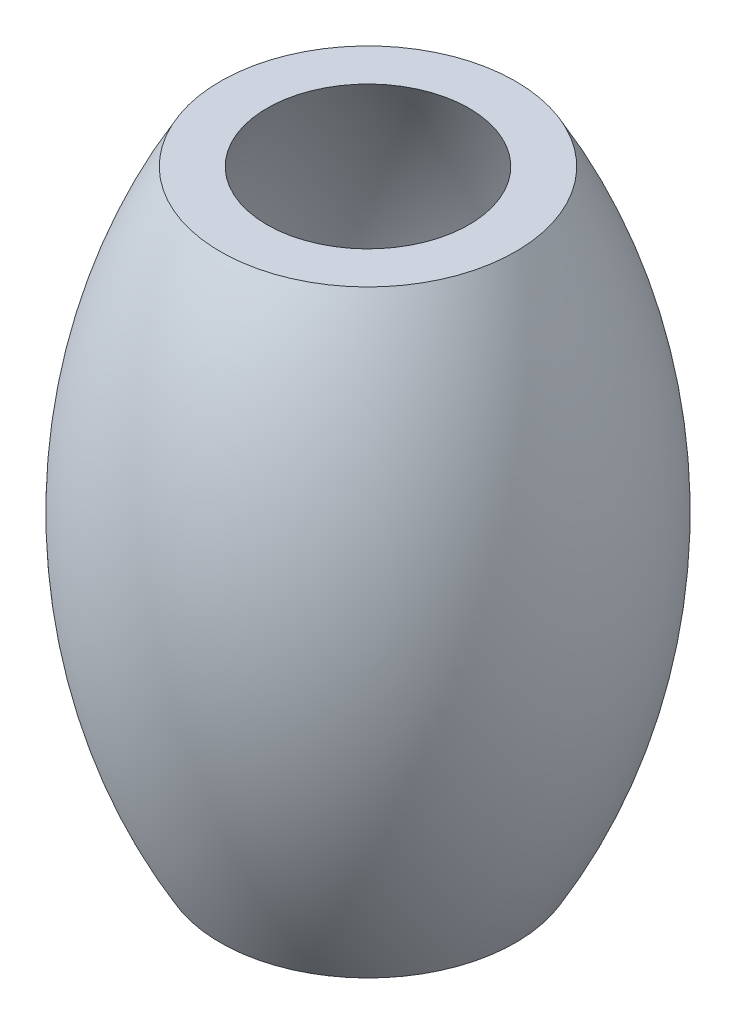
from build123d import *


with BuildPart() as part:
    # Sketch1 → Revolve1 (revolve)
    with BuildSketch(Plane.XY, mode=Mode.PRIVATE) as revolve1_sk:
        with BuildLine():
            Line((-2.531209361, 7.5), (-3.7, 7.5))
            ThreePointArc((-3.7, 7.5), (-5.709618943, 0), (-3.7, -7.5))
            Line((-3.7, -7.5), (-2.531209361, -7.5))
            ThreePointArc((-2.531209361, -7.5), (-4.709618943, 0), (-2.531209361, 7.5))
        make_face()
    revolve(revolve1_sk.sketch.rotate(Axis((0, -10.721793516, 0), (0, 1, 0)), 270), axis=Axis((0, -10.721793516, 0), (0, 1, 0)))


solid = part.part
